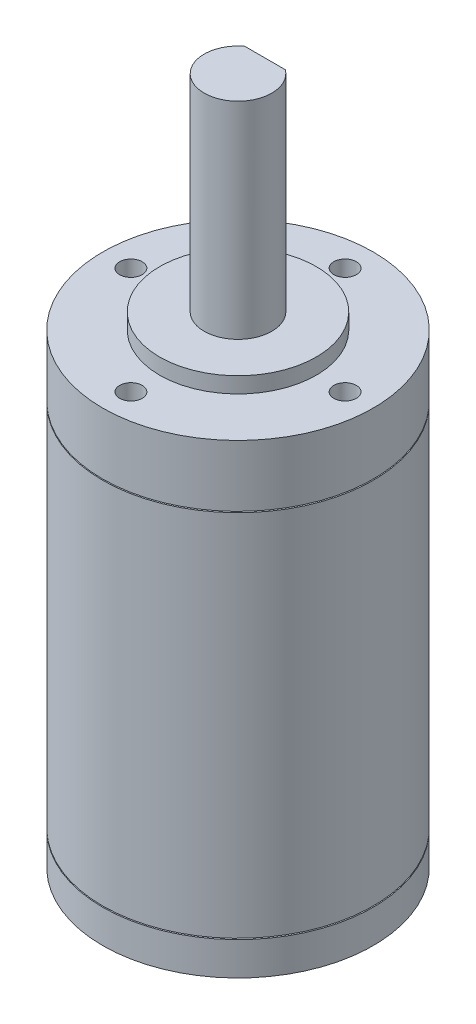
from build123d import *

# Parameters (mm, degrees)
SKETCH_1_R               = 12
EXTRUDE_1_DEPTH          = 41.3
SHELL_6_T                = 2.1
SKETCH_2_R               = 6.95
EXTRUDE_2_DEPTH          = 1.4
SKETCH_3_R               = 3
EXTRUDE_3_DEPTH          = 18.3
CUT_EXTRUDE_1_DEPTH      = 15
SKETCH_5_R               = 3.1
CUT_EXTRUDE_2_DEPTH      = 10
CHAMFER_1_SIZE           = 0.9
SKETCH_7_R               = 1
CUT_EXTRUDE_3_DEPTH      = 10
PATTERN_CIRCULAR_1_COUNT = 4
SKETCH_8_R               = 1.5
CUT_EXTRUDE_4_DEPTH      = 10
PATTERN_CIRCULAR_2_COUNT = 2
SKETCH_10_W              = 1
SKETCH_10_H              = 0.1


with BuildPart() as part:
    # 草图1 → 凸台-拉伸1 (new body)
    with BuildSketch(Plane(origin=(0, 0, 0), x_dir=(1, 0, 0), z_dir=(0, 1, 0))):
        with Locations(Location((0, 0, 0), (0, 0, 90))):
            Circle(SKETCH_1_R)
    extrude(amount=EXTRUDE_1_DEPTH)

    # 抽壳6 (no face opened: a closed hollow body)
    add(offset(amount=-SHELL_6_T, mode=Mode.PRIVATE), mode=Mode.SUBTRACT)

    # 草图2 → 凸台-拉伸2 (add)
    with BuildSketch(Plane(origin=(0, 41.3, 0), x_dir=(1, 0, 0), z_dir=(0, 1, 0))):
        with Locations(Location((0, 0, 0), (0, 0, 270))):
            Circle(SKETCH_2_R)
    extrude(amount=EXTRUDE_2_DEPTH)

    # 草图3 → 凸台-拉伸3 (add)
    with BuildSketch(Plane(origin=(0, 42.7, 0), x_dir=(1, 0, 0), z_dir=(0, 1, 0))):
        with Locations(Location((0, 0, 0), (0, 0, 270))):
            Circle(SKETCH_3_R)
    extrude(amount=EXTRUDE_3_DEPTH)

    # 草图4 → 切除-拉伸1 (cut)
    with BuildSketch(Plane(origin=(0, 61, 0), x_dir=(1, 0, 0), z_dir=(0, 1, 0))):
        Polygon((-4.180388969, 2.4), (5.154958177, 2.4), (-0.718103627, 5.682759436), align=None)
    extrude(amount=-CUT_EXTRUDE_1_DEPTH, mode=Mode.SUBTRACT)

    # 草图5 → 切除-拉伸2 (cut)
    with BuildSketch(Plane.XZ):
        with Locations(Location((0, 0, 0), (0, 0, 270))):
            Circle(SKETCH_5_R)
    extrude(amount=-CUT_EXTRUDE_2_DEPTH, mode=Mode.SUBTRACT)

    # 倒角1
    chamfer_1_edges = [part.edges().sort_by_distance(p)[0] for p in [
        (0, 0, 3.1),
    ]]
    chamfer(chamfer_1_edges, length=CHAMFER_1_SIZE)

    # 草图7 → 切除-拉伸3 (cut)
    with BuildSketch(Plane(origin=(0, 41.3, 0), x_dir=(1, 0, 0), z_dir=(0, 1, 0))):
        with Locations(Location((0, 9.5, 0), (0, 0, 270))):
            Circle(SKETCH_7_R)
    cut_extrude_3 = extrude(amount=-CUT_EXTRUDE_3_DEPTH, mode=Mode.SUBTRACT)

    # 阵列(圆周)1: 切除-拉伸3 ×4 about axis
    pattern_circular_1_axis = Axis((0, 0, 0), (0, 1, 0))
    for i in range(1, PATTERN_CIRCULAR_1_COUNT):
        add(cut_extrude_3.rotate(pattern_circular_1_axis, i * 360 / PATTERN_CIRCULAR_1_COUNT), mode=Mode.SUBTRACT)

    # 草图8 → 切除-拉伸4 (cut)
    with BuildSketch(Plane.XZ):
        with Locations(Location((0, 8, 0), (0, 0, 270))):
            Circle(SKETCH_8_R)
    cut_extrude_4 = extrude(amount=-CUT_EXTRUDE_4_DEPTH, mode=Mode.SUBTRACT)

    # 阵列(圆周)2: 切除-拉伸4 ×2 about axis
    pattern_circular_2_axis = Axis((0, 0, 0), (0, 1, 0))
    for i in range(1, PATTERN_CIRCULAR_2_COUNT):
        add(cut_extrude_4.rotate(pattern_circular_2_axis, i * 360 / PATTERN_CIRCULAR_2_COUNT), mode=Mode.SUBTRACT)

    # 草图10 → 切除-旋转1 (revolve, cut)
    with BuildSketch(Plane.XY, mode=Mode.PRIVATE) as cut_revolve_1_sk:
        with Locations((11.890198227, 35.8)):
            Rectangle(SKETCH_10_W, SKETCH_10_H)
        with Locations((12, 3)):
            Rectangle(SKETCH_10_W, SKETCH_10_H)
    revolve(cut_revolve_1_sk.sketch.rotate(Axis((0, 62.182119541, 0), (0, -1, 0)), 233.130102354), axis=Axis((0, 62.182119541, 0), (0, -1, 0)), mode=Mode.SUBTRACT)


solid = part.part
